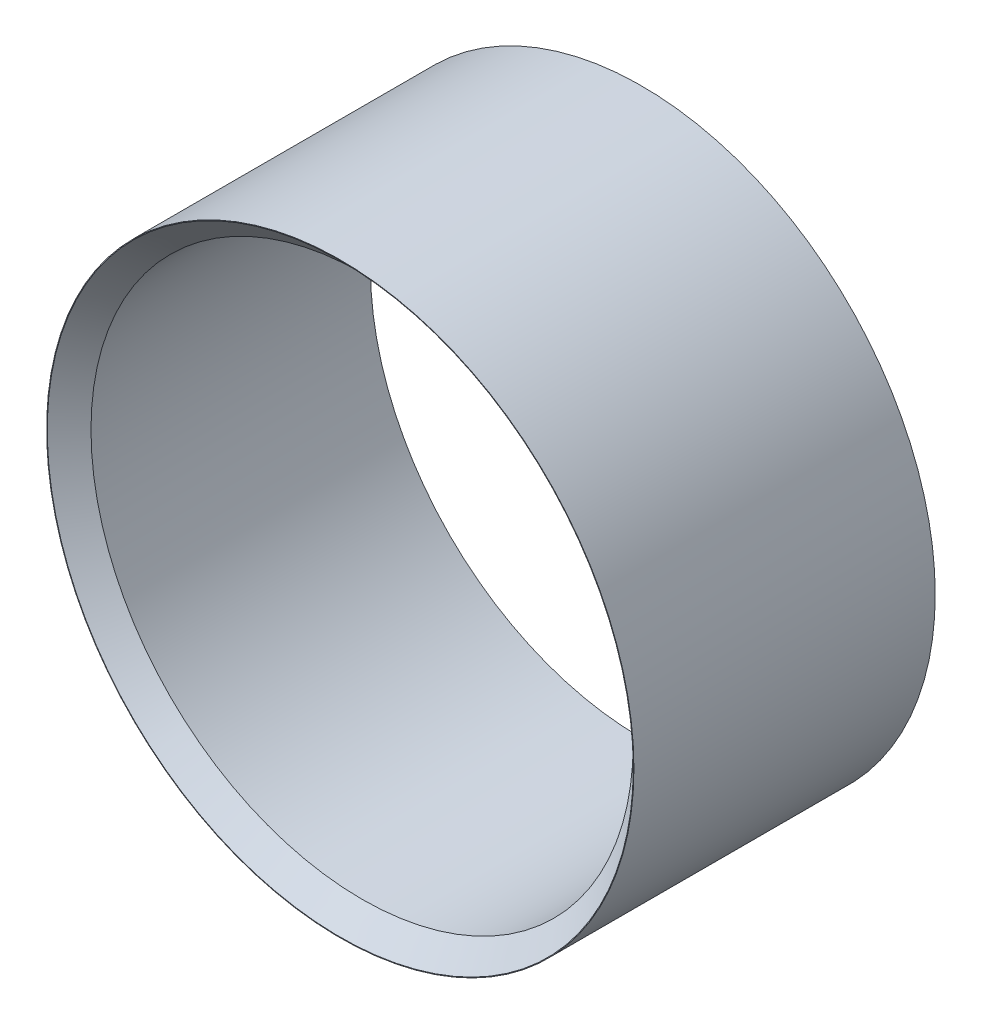
from build123d import *

# Parameters (mm, degrees)
SKETCH2_R           = 17.0561
SKETCH2_R_2         = 15.748
BOSS_EXTRUDE1_DEPTH = 17.5006
CHAMFER1_SIZE       = 1.27


with BuildPart() as part:
    # Sketch2 → Boss-Extrude1 (new body)
    with BuildSketch(Plane.XY):
        Circle(SKETCH2_R)
        Circle(SKETCH2_R_2, mode=Mode.SUBTRACT)
    extrude(amount=BOSS_EXTRUDE1_DEPTH)

    # Chamfer1
    chamfer1_edges = [part.edges().sort_by_distance(p)[0] for p in [
        (-15.748, 0, 17.5006),
    ]]
    chamfer(chamfer1_edges, length=CHAMFER1_SIZE)


solid = part.part
